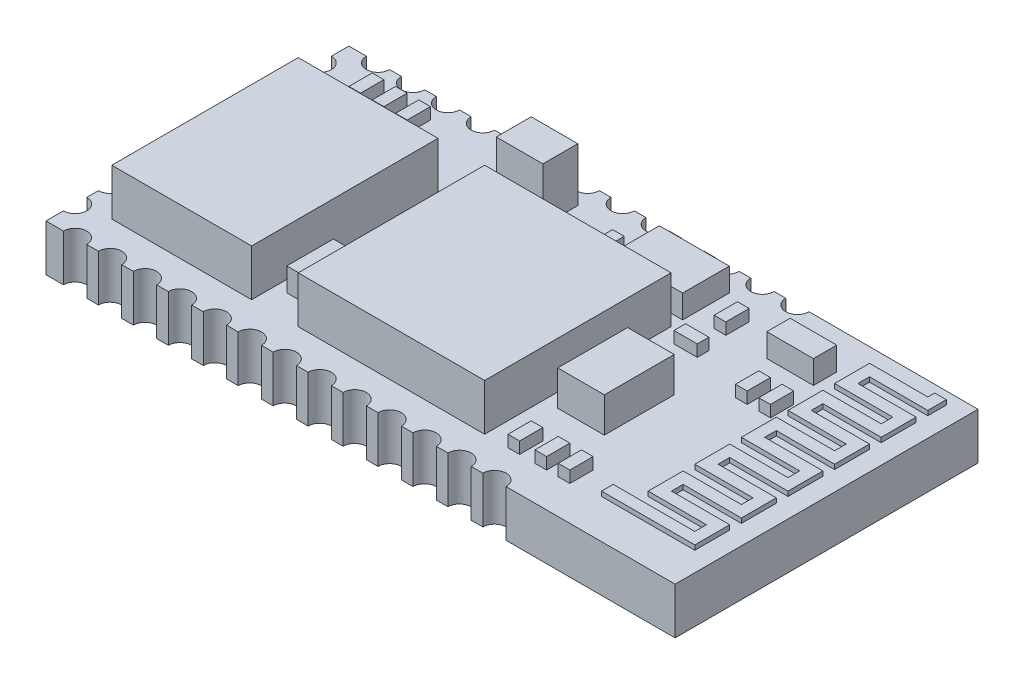
from build123d import *

# Parameters (mm, degrees)
SKETCH1_W           = 27
SKETCH1_H           = 13
BOSS_EXTRUDE1_DEPTH = 2
SKETCH2_R           = 0.5
CUT_EXTRUDE7_DEPTH  = 2
SKETCH9_R           = 0.5
CUT_EXTRUDE9_DEPTH  = 2
SKETCH10_W          = 6
SKETCH10_H          = 8
SKETCH10_W_2        = 8
BOSS_EXTRUDE2_DEPTH = 2
SKETCH12_W          = 3
SKETCH12_H          = 2
BOSS_EXTRUDE3_DEPTH = 1
SKETCH13_W          = 2
SKETCH13_H          = 1.5
BOSS_EXTRUDE4_DEPTH = 2.3
SKETCH14_W          = 0.5
SKETCH14_H          = 1
SKETCH14_W_2        = 1
SKETCH14_H_2        = 0.5
BOSS_EXTRUDE6_DEPTH = 0.5
SKETCH15_W          = 2
SKETCH15_H          = 1
SKETCH15_W_2        = 1
SKETCH15_H_2        = 2
BOSS_EXTRUDE7_DEPTH = 1
SKETCH16_W          = 2
SKETCH16_H          = 3
BOSS_EXTRUDE8_DEPTH = 1.5
BOSS_EXTRUDE9_DEPTH = 0.2


with BuildPart() as part:
    # Sketch1 → Boss-Extrude1 (new body)
    with BuildSketch(Plane(origin=(0, 0, 0), x_dir=(1, 0, 0), z_dir=(0, 1, 0))):
        Rectangle(SKETCH1_W, SKETCH1_H)
    extrude(amount=BOSS_EXTRUDE1_DEPTH)

    # Sketch2 → Cut-Extrude7 (cut)
    with BuildSketch(Plane(origin=(0, 2, 0), x_dir=(1, 0, 0), z_dir=(0, 1, 0))):
        with Locations((-13.5, 5.25)):
            Circle(SKETCH2_R)
        with Locations((-13.5, 3.75)):
            Circle(SKETCH2_R)
        with Locations((-13.5, 2.25)):
            Circle(SKETCH2_R)
        with Locations((-13.5, 0.75)):
            Circle(SKETCH2_R)
        with Locations((-13.5, -0.75)):
            Circle(SKETCH2_R)
        with Locations((-13.5, -2.25)):
            Circle(SKETCH2_R)
        with Locations((-13.5, -3.75)):
            Circle(SKETCH2_R)
        with Locations((-13.5, -5.25)):
            Circle(SKETCH2_R)
    extrude(amount=-CUT_EXTRUDE7_DEPTH, mode=Mode.SUBTRACT)

    # Sketch9 → Cut-Extrude9 (cut)
    with BuildSketch(Plane(origin=(0, 2, 0), x_dir=(1, 0, 0), z_dir=(0, 1, 0))):
        with Locations((-12.25, 6.5)):
            Circle(SKETCH9_R)
        with Locations((-10.75, 6.5)):
            Circle(SKETCH9_R)
        with Locations((-9.25, 6.5)):
            Circle(SKETCH9_R)
        with Locations((-7.75, 6.5)):
            Circle(SKETCH9_R)
        with Locations((-6.25, 6.5)):
            Circle(SKETCH9_R)
        with Locations((-4.75, 6.5)):
            Circle(SKETCH9_R)
        with Locations((-3.25, 6.5)):
            Circle(SKETCH9_R)
        with Locations((-1.75, 6.5)):
            Circle(SKETCH9_R)
        with Locations((-0.25, 6.5)):
            Circle(SKETCH9_R)
        with Locations((1.25, 6.5)):
            Circle(SKETCH9_R)
        with Locations((2.75, 6.5)):
            Circle(SKETCH9_R)
        with Locations((4.25, 6.5)):
            Circle(SKETCH9_R)
        with Locations((5.75, 6.5)):
            Circle(SKETCH9_R)
        with Locations((-1.75, -6.5)):
            Circle(SKETCH9_R)
        with Locations((-0.25, -6.5)):
            Circle(SKETCH9_R)
        with Locations((-3.25, -6.5)):
            Circle(SKETCH9_R)
        with Locations((2.75, -6.5)):
            Circle(SKETCH9_R)
        with Locations((-7.75, -6.5)):
            Circle(SKETCH9_R)
        with Locations((1.25, -6.5)):
            Circle(SKETCH9_R)
        with Locations((-9.25, -6.5)):
            Circle(SKETCH9_R)
        with Locations((-6.25, -6.5)):
            Circle(SKETCH9_R)
        with Locations((4.25, -6.5)):
            Circle(SKETCH9_R)
        with Locations((-12.25, -6.5)):
            Circle(SKETCH9_R)
        with Locations((-10.75, -6.5)):
            Circle(SKETCH9_R)
        with Locations((-4.75, -6.5)):
            Circle(SKETCH9_R)
        with Locations((5.75, -6.5)):
            Circle(SKETCH9_R)
    extrude(amount=-CUT_EXTRUDE9_DEPTH, mode=Mode.SUBTRACT)

    # Sketch10 → Boss-Extrude2 (add)
    with BuildSketch(Plane(origin=(0, 2, 0), x_dir=(1, 0, 0), z_dir=(0, 1, 0))):
        with Locations((-9.158592774, -1.016549072)):
            Rectangle(SKETCH10_W, SKETCH10_H)
        with Locations((-0.158592774, -1.016549072)):
            Rectangle(SKETCH10_W_2, SKETCH10_H)
    extrude(amount=BOSS_EXTRUDE2_DEPTH)

    # Sketch12 → Boss-Extrude3 (add)
    with BuildSketch(Plane(origin=(0, 2, 0), x_dir=(1, 0, 0), z_dir=(0, 1, 0))):
        with Locations((2.341407226, 4.483450928)):
            Rectangle(SKETCH12_W, SKETCH12_H)
    extrude(amount=BOSS_EXTRUDE3_DEPTH)

    # Sketch13 → Boss-Extrude4 (add)
    with BuildSketch(Plane(origin=(0, 2, 0), x_dir=(1, 0, 0), z_dir=(0, 1, 0))):
        with Locations((-3.658592774, 4.733450928)):
            Rectangle(SKETCH13_W, SKETCH13_H)
    extrude(amount=BOSS_EXTRUDE4_DEPTH)

    # Sketch14 → Boss-Extrude6 (add)
    with BuildSketch(Plane(origin=(0, 2, 0), x_dir=(1, 0, 0), z_dir=(0, 1, 0))):
        with Locations((-9.25, 5)):
            Rectangle(SKETCH14_W, SKETCH14_H)
        with Locations((-5.158592774, 0)):
            Rectangle(SKETCH14_W, SKETCH14_H)
        with Locations((5.091407226, 4.336621963)):
            Rectangle(SKETCH14_W, SKETCH14_H)
        with Locations((8.116137584, 2.225585846)):
            Rectangle(SKETCH14_W, SKETCH14_H)
        with Locations((9.116137584, 2.225585846)):
            Rectangle(SKETCH14_W, SKETCH14_H)
        with Locations((6.25, -4.516549072)):
            Rectangle(SKETCH14_W, SKETCH14_H)
        with Locations((-11.25, 5)):
            Rectangle(SKETCH14_W, SKETCH14_H)
        with Locations((-10.25, 5)):
            Rectangle(SKETCH14_W, SKETCH14_H)
        with Locations((-0.270236952, 4.336621963)):
            Rectangle(SKETCH14_W, SKETCH14_H)
        with Locations((-5.158592774, 3)):
            Rectangle(SKETCH14_W, SKETCH14_H)
        with Locations((5.045928456, 2.653097674)):
            Rectangle(SKETCH14_W_2, SKETCH14_H_2)
        with Locations((7.25, -4.516549072)):
            Rectangle(SKETCH14_W, SKETCH14_H)
        with Locations((5.091407226, -4.516549072)):
            Rectangle(SKETCH14_W, SKETCH14_H)
    extrude(amount=BOSS_EXTRUDE6_DEPTH)

    # Sketch15 → Boss-Extrude7 (add)
    with BuildSketch(Plane(origin=(0, 2, 0), x_dir=(1, 0, 0), z_dir=(0, 1, 0))):
        with Locations((8.084421652, 4.353233129)):
            Rectangle(SKETCH15_W, SKETCH15_H)
        with Locations((-5.160364115, -3.004825478)):
            Rectangle(SKETCH15_W_2, SKETCH15_H_2)
    extrude(amount=BOSS_EXTRUDE7_DEPTH)

    # Sketch16 → Boss-Extrude8 (add)
    with BuildSketch(Plane(origin=(0, 2, 0), x_dir=(1, 0, 0), z_dir=(0, 1, 0))):
        with Locations((5.444247196, -0.981381649)):
            Rectangle(SKETCH16_W, SKETCH16_H)
    extrude(amount=BOSS_EXTRUDE8_DEPTH)

    # Sketch17 → Boss-Extrude9 (add)
    with BuildSketch(Plane(origin=(0, 2, 0), x_dir=(1, 0, 0), z_dir=(0, 1, 0))):
        Polygon((12.163913607, 5.68064174), (9.663913607, 5.68064174), (9.663913607, 4.18064174), (12.163913607, 4.18064174), (12.163913607, 3.68064174), (9.663913607, 3.68064174), (9.663913607, 2.18064174), (12.163913607, 2.18064174), (12.163913607, 1.68064174), (9.663913607, 1.68064174), (9.663913607, 0.18064174), (12.163913607, 0.18064174), (12.163913607, -0.31935826), (9.663913607, -0.31935826), (9.663913607, -1.81935826), (12.163913607, -1.81935826), (12.163913607, -2.31935826), (9.663913607, -2.31935826), (9.663913607, -3.81935826), (12.163913607, -3.81935826), (12.163913607, -4.31935826), (8.663913607, -4.31935826), (8.663913607, -4.81935826), (12.663913607, -4.81935826), (12.663913607, -3.31935826), (10.163913607, -3.31935826), (10.163913607, -2.81935826), (12.663913607, -2.81935826), (12.663913607, -1.31935826), (10.163913607, -1.31935826), (10.163913607, -0.81935826), (12.663913607, -0.81935826), (12.663913607, 0.68064174), (10.163913607, 0.68064174), (10.163913607, 1.18064174), (12.663913607, 1.18064174), (12.663913607, 2.68064174), (10.163913607, 2.68064174), (10.163913607, 3.18064174), (12.663913607, 3.18064174), (12.663913607, 4.68064174), (10.163913607, 4.68064174), (10.163913607, 5.18064174), (12.663913607, 5.18064174), (12.663913607, 5.975044168), (12.163913607, 5.975044168), align=None)
    extrude(amount=BOSS_EXTRUDE9_DEPTH)


solid = part.part
